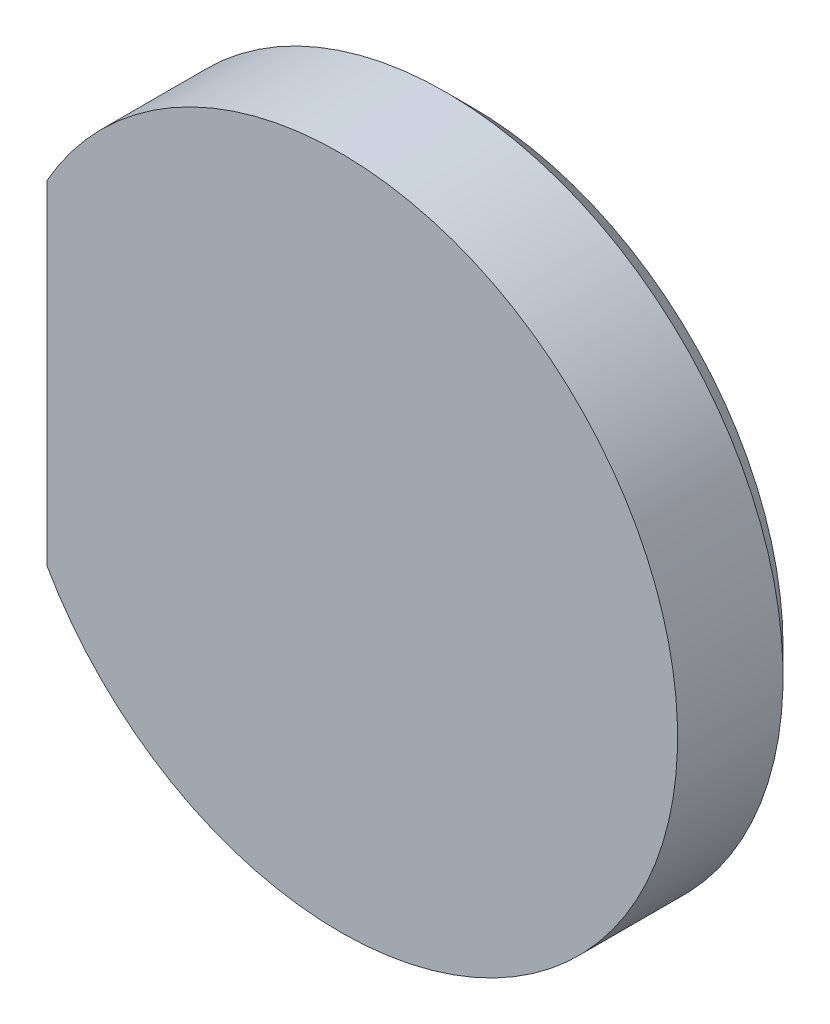
from build123d import *

# Parameters (mm, degrees)
SKETCH_1_R          = 25.6
EXTRUDE_1_DEPTH     = 10
CHAMFER_1_SIZE      = 2
CUT_EXTRUDE_START   = -2.5
CUT_EXTRUDE_1_DEPTH = 2.5
SKETCH_3_R          = 23.2
CUT_EXTRUDE_2_DEPTH = 7.5
CUT_EXTRUDE_3_REACH = 39.56
SKETCH_5_W          = 9.365653714
SKETCH_5_H          = 25.321729798
FILLET_2_R          = 4


with BuildPart() as part:
    # Эскиз1 → Бобышка-Вытянуть1 (new body)
    with BuildSketch(Plane.XY):
        Circle(SKETCH_1_R)
    extrude(amount=EXTRUDE_1_DEPTH)

    # Фаска1
    chamfer_1_edges = [part.edges().sort_by_distance(p)[0] for p in [
        (-25.6, 0, 0),
    ]]
    chamfer(chamfer_1_edges, length=CHAMFER_1_SIZE)

    # Эскиз2 → Вырез-Вытянуть1 (cut)
    with BuildSketch(Plane.XY.offset(10).offset(CUT_EXTRUDE_START)):
        with BuildLine():
            Line((-22.25, -12.660864899), (-22.25, 12.660864899))
            ThreePointArc((-22.25, 12.660864899), (-25.6, 0), (-22.25, -12.660864899))
        make_face()
    extrude(amount=CUT_EXTRUDE_1_DEPTH, mode=Mode.SUBTRACT)

    # Эскиз3 → Вырез-Вытянуть2 (cut)
    with BuildSketch(Plane(origin=(0, 0, 0), x_dir=(-1, 0, 0), z_dir=(0, 0, -1))):
        Circle(SKETCH_3_R)
    extrude(amount=-CUT_EXTRUDE_2_DEPTH, mode=Mode.SUBTRACT)

    # Вырез-Вытянуть3: up to this face of the body (flat: up to its plane)
    cut_extrude_3_end = Plane(part.part.faces().sort_by_distance((0.112414177, 0, 7.5))[0])
    # Эскиз5 → Вырез-Вытянуть3 (cut, up to the picked face)
    with BuildSketch(Plane(origin=(0, 0, 0), x_dir=(-1, 0, 0), z_dir=(0, 0, -1)), mode=Mode.PRIVATE) as cut_extrude_3_sk1:
        with Locations((22.25, 0)):
            Rectangle(SKETCH_5_W, SKETCH_5_H)
    cut_extrude_3_tool1 = split(extrude(cut_extrude_3_sk1.sketch, amount=-CUT_EXTRUDE_3_REACH, mode=Mode.PRIVATE), bisect_by=cut_extrude_3_end, keep=Keep.BOTH, mode=Mode.PRIVATE)
    add(cut_extrude_3_tool1.solids().sort_by(Axis((-22.25, 0, 0), (0, 0, 1)))[0], mode=Mode.SUBTRACT)

    # Скругление2
    fillet_2_edges = [part.edges().sort_by_distance(p)[0] for p in [
        (-19.440743299, 12.660864899, 3.75),
        (-19.440743299, -12.660864899, 3.75),
    ]]
    fillet(fillet_2_edges, radius=FILLET_2_R)


solid = part.part
